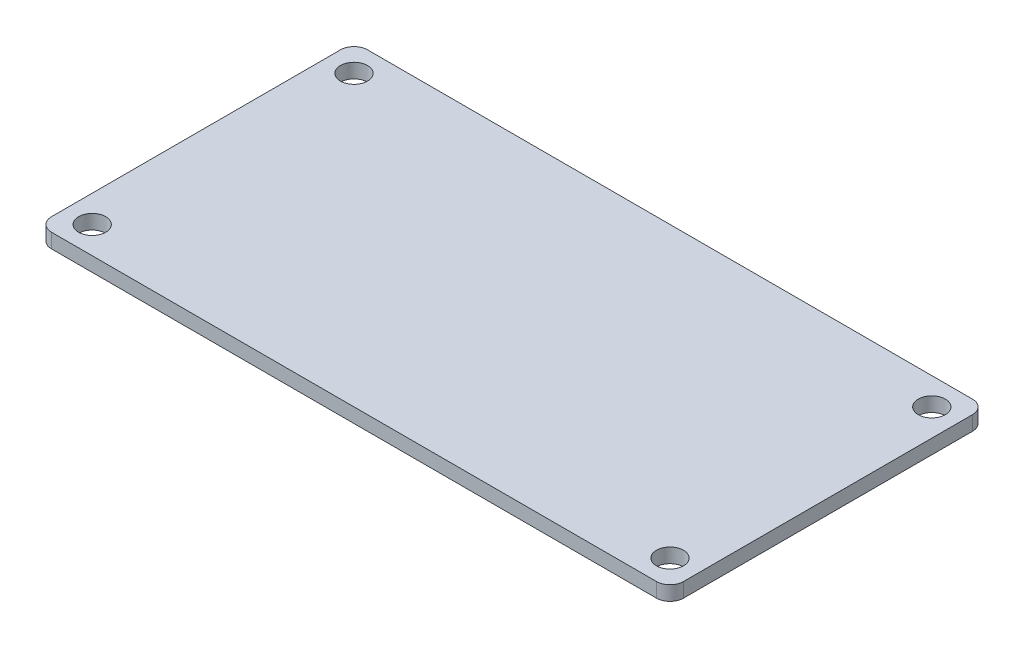
from build123d import *

# Parameters (mm, degrees)
PCB_BASE_DEPTH       = 1.6
SKETCH2_R            = 1.5
MOUNTING_HOLES_DEPTH = 1.6


with BuildPart() as part:
    # Sketch1 → PCB Base (new body)
    with BuildSketch(Plane(origin=(0, 0, 0), x_dir=(1, 0, 0), z_dir=(0, 1, 0))):
        with BuildLine():
            Line((-33.5, -17.5), (33.5, -17.5))
            ThreePointArc((33.5, -17.5), (34.560660172, -17.060660172), (35, -16))
            Line((35, -16), (35, 16))
            ThreePointArc((35, 16), (34.560660172, 17.060660172), (33.5, 17.5))
            Line((33.5, 17.5), (-33.5, 17.5))
            ThreePointArc((-33.5, 17.5), (-34.560660172, 17.060660172), (-35, 16))
            Line((-35, 16), (-35, -16))
            ThreePointArc((-35, -16), (-34.560660172, -17.060660172), (-33.5, -17.5))
        make_face()
    extrude(amount=PCB_BASE_DEPTH)

    # Sketch2 → Mounting Holes (cut)
    with BuildSketch(Plane(origin=(0, 1.6, 0), x_dir=(1, 0, 0), z_dir=(0, 1, 0))):
        with Locations(Location((-32, 14.5, 0), (0, 0, 270))):
            Circle(SKETCH2_R)
        with Locations(Location((32, 14.5, 0), (0, 0, 90))):
            Circle(SKETCH2_R)
        with Locations(Location((32, -14.5, 0), (0, 0, 270))):
            Circle(SKETCH2_R)
        with Locations(Location((-32, -14.5, 0), (0, 0, 90))):
            Circle(SKETCH2_R)
    extrude(amount=-MOUNTING_HOLES_DEPTH, mode=Mode.SUBTRACT)


solid = part.part
